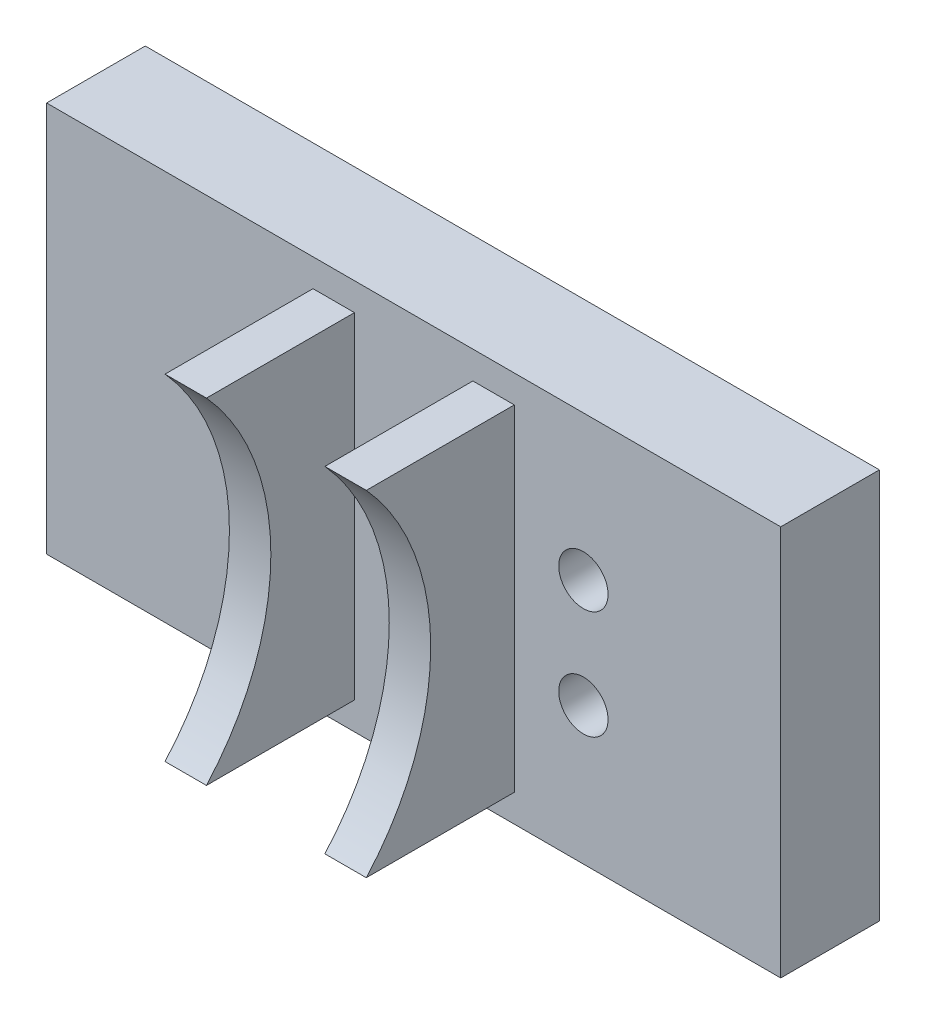
from build123d import *

# Parameters (mm, degrees)
SKETCH1_W                = 74.4
SKETCH1_H                = 39.6
BOSS_EXTRUDE4_DEPTH      = 10
SKETCH4_W                = 4.2
SKETCH4_H                = 34
BOSS_EXTRUDE7_DEPTH      = 15
CUT_EXTRUDE6_DEPTH       = 60.390731662
CUT_EXTRUDE6_DEPTH_BACK  = 8
CUT_EXTRUDE12_DEPTH      = 57.095802048
CUT_EXTRUDE12_DEPTH_BACK = 15
SKETCH7_R                = 2.5
CUT_EXTRUDE13_DEPTH      = 15


with BuildPart() as part:
    # Sketch1 → Boss-Extrude4 (new body)
    with BuildSketch(Plane.XY):
        with Locations((-59.791289062, -5.802714844)):
            Rectangle(SKETCH1_W, SKETCH1_H)
    extrude(amount=BOSS_EXTRUDE4_DEPTH)

    # Sketch4 → Boss-Extrude7 (add)
    with BuildSketch(Plane.XY.offset(10)):
        with Locations((-67.891289062, -5.802714844)):
            Rectangle(SKETCH4_W, SKETCH4_H)
        Polygon((-49.591289063, 11.197285156), (-53.791289062, 11.197285156), (-53.791289062, -22.802714844), (-49.591289063, -22.802714844), align=None)
    extrude(amount=BOSS_EXTRUDE7_DEPTH)

    # Sketch5 → Cut-Extrude6 (cut, two sides: drawn at the far end of the back side and taken through both)
    with BuildSketch(Plane(origin=(-49.591289063, 0, 0), x_dir=(0, 0, -1), z_dir=(1, 0, 0)).offset(-CUT_EXTRUDE6_DEPTH_BACK)):
        with BuildLine():
            Line((-91.244649925, 84.737426344), (-25, 11.197285156))
            ThreePointArc((-25, 11.197285156), (-18.472201779, -5.802714844), (-25, -22.802714844))
            Line((-25, -22.802714844), (-91.244649925, -96.342856031))
            Line((-91.244649925, -96.342856031), (-289.199250877, -96.342856031))
            Line((-289.199250877, -96.342856031), (-289.199250877, 84.737426344))
            Line((-289.199250877, 84.737426344), (-91.244649925, 84.737426344))
        make_face()
    extrude(amount=CUT_EXTRUDE6_DEPTH + CUT_EXTRUDE6_DEPTH_BACK, mode=Mode.SUBTRACT)

    # Sketch6 → Cut-Extrude12 (cut, two sides: drawn at the far end of the back side and taken through both)
    with BuildSketch(Plane(origin=(-65.791289062, 0, 0), x_dir=(0, 0, -1), z_dir=(1, 0, 0)).offset(-CUT_EXTRUDE12_DEPTH_BACK)):
        with BuildLine():
            Line((-91.244649925, -96.342856031), (-25, -22.802714844))
            ThreePointArc((-25, -22.802714844), (-18.472201779, -5.802714844), (-25, 11.197285156))
            Line((-25, 11.197285156), (-91.244649925, 84.737426344))
            Line((-91.244649925, 84.737426344), (-289.199250877, 84.737426344))
            Line((-289.199250877, 84.737426344), (-289.199250877, -96.342856031))
            Line((-289.199250877, -96.342856031), (-91.244649925, -96.342856031))
        make_face()
    extrude(amount=CUT_EXTRUDE12_DEPTH + CUT_EXTRUDE12_DEPTH_BACK, mode=Mode.SUBTRACT)

    # Sketch7 → Cut-Extrude13 (cut)
    with BuildSketch(Plane.XY.offset(10)):
        with Locations((-42.591289062, -11.682714844)):
            Circle(SKETCH7_R)
        with Locations((-42.591289062, -0.682714844)):
            Circle(SKETCH7_R)
        with Locations((-76.008712531, -0.682714844)):
            Circle(SKETCH7_R)
        with Locations((-76.008712531, -11.682714844)):
            Circle(SKETCH7_R)
    extrude(amount=-CUT_EXTRUDE13_DEPTH, mode=Mode.SUBTRACT)


solid = part.part
